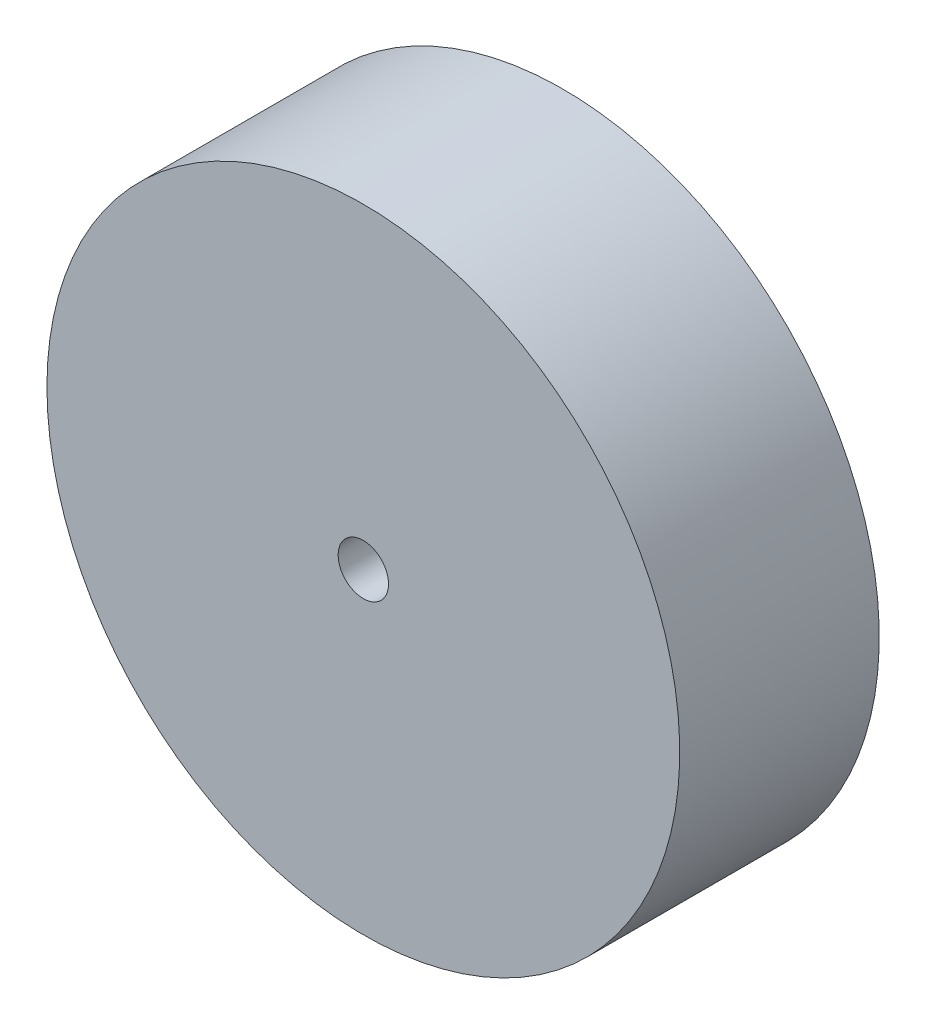
from build123d import *

# Parameters (mm, degrees)
CROQUIS1_R              = 31.4
CROQUIS1_R_2            = 2.5
SALIENTE_EXTRUIR1_DEPTH = 19.8


with BuildPart() as part:
    # Croquis1 → Saliente-Extruir1 (new body)
    with BuildSketch(Plane.XY):
        with Locations(Location((0, 0, 0), (0, 0, 180))):
            Circle(CROQUIS1_R)
        with Locations(Location((0, 0, 0), (0, 0, 180))):
            Circle(CROQUIS1_R_2, mode=Mode.SUBTRACT)
    extrude(amount=SALIENTE_EXTRUIR1_DEPTH)


solid = part.part
